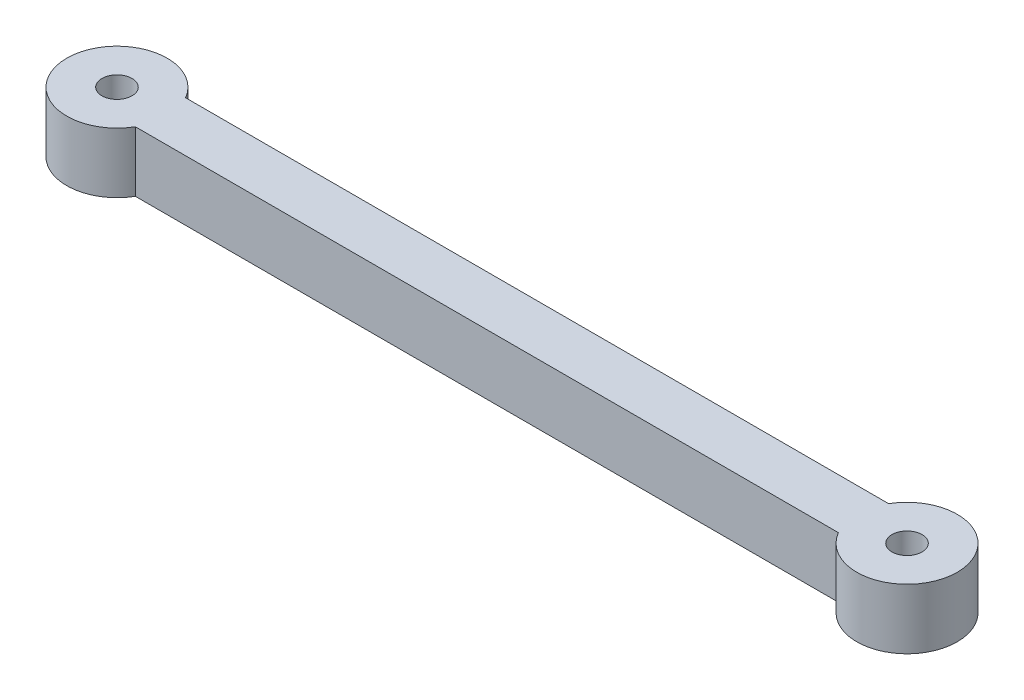
from build123d import *

# Parameters (mm, degrees)
BOSS_EXTRUDE1_DEPTH = 6
SKETCH2_R           = 1.5
CUT_EXTRUDE1_DEPTH  = 46.012888838


with BuildPart() as part:
    # Sketch1 → Boss-Extrude1 (new body)
    with BuildSketch(Plane(origin=(0, 0, 0), x_dir=(1, 0, 0), z_dir=(0, 1, 0))):
        with BuildLine():
            Line((-35, 2.5), (35, 2.5))
            ThreePointArc((35, 2.5), (44.330127019, 0), (35, -2.5))
            Line((35, -2.5), (-35, -2.5))
            ThreePointArc((-35, -2.5), (-44.330127019, 0), (-35, 2.5))
        make_face()
    extrude(amount=BOSS_EXTRUDE1_DEPTH)

    # Sketch2 → Cut-Extrude1 (cut, through all)
    with BuildSketch(Plane(origin=(0, 6, 0), x_dir=(1, 0, 0), z_dir=(0, 1, 0))):
        with Locations(Location((-39.330127019, 0, 0), (0, 0, 270))):
            Circle(SKETCH2_R)
        with Locations(Location((39.330127019, 0, 0), (0, 0, 270))):
            Circle(SKETCH2_R)
    extrude(amount=-CUT_EXTRUDE1_DEPTH, mode=Mode.SUBTRACT)


solid = part.part
